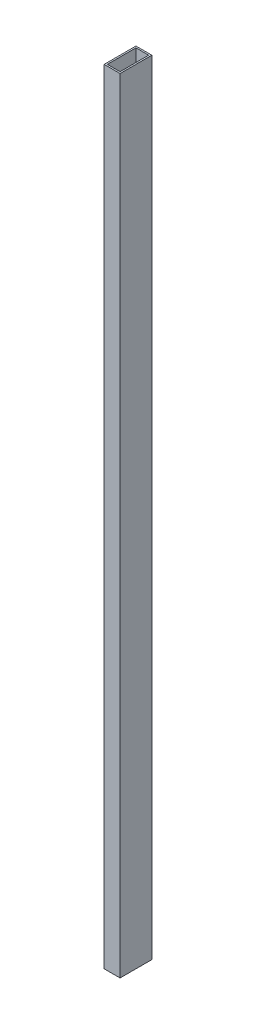
from build123d import *

# Parameters (mm, degrees)
CROQUIS1_W              = 40
CROQUIS1_H              = 985.51
SALIENTE_EXTRUIR1_DEPTH = 20
CROQUIS2_W              = 16
CROQUIS2_H              = 36
CORTAR_EXTRUIR1_DEPTH   = 1000


with BuildPart() as part:
    # Croquis1 → Saliente-Extruir1 (new body)
    with BuildSketch(Plane(origin=(0, 0, 0), x_dir=(0, 0, -1), z_dir=(1, 0, 0))):
        with Locations((-20, 492.755)):
            Rectangle(CROQUIS1_W, CROQUIS1_H)
    extrude(amount=SALIENTE_EXTRUIR1_DEPTH)

    # Croquis2 → Cortar-Extruir1 (cut)
    with BuildSketch(Plane(origin=(0, 985.51, 0), x_dir=(1, 0, 0), z_dir=(0, 1, 0))):
        with Locations((10, -20)):
            Rectangle(CROQUIS2_W, CROQUIS2_H)
    extrude(amount=-CORTAR_EXTRUIR1_DEPTH, mode=Mode.SUBTRACT)


solid = part.part
